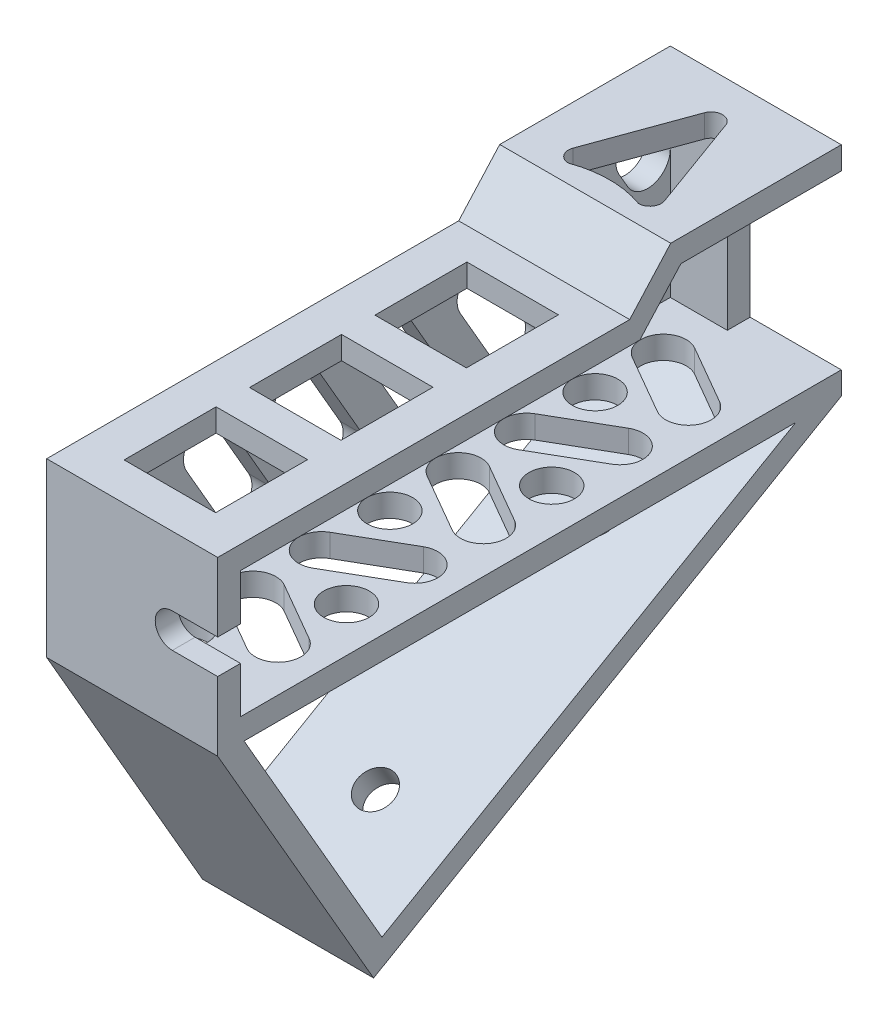
from build123d import *

# Parameters (mm, degrees)
EXTRUDE_1_DEPTH     = 15
EXTRUDE_2_DEPTH     = 2
CUT_EXTRUDE_1_REACH = 61.227
EXTRUDE_3_DEPTH     = 15
CUT_EXTRUDE_2_REACH = 64.285
SKETCH_4_W          = 8
SKETCH_4_H          = 15.1
CUT_EXTRUDE_3_REACH = 50.798
SKETCH_5_R          = 1.6
CUT_EXTRUDE_5_REACH = 42.44
CUT_EXTRUDE_6_REACH = 54.949
SKETCH_7_W          = 8.022612094
SKETCH_7_H          = 8.068386681
CUT_EXTRUDE_7_REACH = 42.408
SKETCH_8_R          = 2


with BuildPart() as part:
    # 草图1 → 凸台-拉伸1 (new body)
    with BuildSketch(Plane(origin=(0, 0, 0), x_dir=(0, 0, -1), z_dir=(1, 0, 0))):
        Polygon((27.35, 17.05), (12.38700707, 17.05), (8.78700707, 13.05), (-27.35, 13.05), (-27.35, -2.05), (27.35, -2.05), align=None)
        Polygon((9.67773188, 11.05), (13.27773188, 15.05), (25.35, 15.05), (25.35, -0.05), (-25.35, -0.05), (-25.35, 11.05), align=None, mode=Mode.SUBTRACT)
    extrude(amount=EXTRUDE_1_DEPTH)

    # 草图1<3> → 凸台-拉伸2 (add)
    with BuildSketch(Plane(origin=(0, 0, 0), x_dir=(0, 0, -1), z_dir=(1, 0, 0))):
        Polygon((25.35, 15.05), (13.27773188, 15.05), (9.67773188, 11.05), (-25.35, 11.05), (-25.35, -0.05), (25.35, -0.05), align=None)
    extrude(amount=EXTRUDE_2_DEPTH)

    # 草图2 → 切除-拉伸1 (cut, up to next)
    with BuildSketch(Plane.XY.offset(27.35), mode=Mode.PRIVATE) as cut_extrude_1_sk1:
        with BuildLine():
            Line((15, 7), (11.02, 7))
            ThreePointArc((11.02, 7), (9.52, 5.5), (11.02, 4))
            Line((11.02, 4), (15, 4))
            Line((15, 4), (15, 7))
        make_face()
    cut_extrude_1_tool1 = extrude(cut_extrude_1_sk1.sketch, amount=-CUT_EXTRUDE_1_REACH, mode=Mode.PRIVATE) & part.part
    add(cut_extrude_1_tool1.solids().sort_by_distance((12.410086, 5.5, 27.35))[0], mode=Mode.SUBTRACT)

    # 草图3 → 凸台-拉伸3 (add)
    with BuildSketch(Plane(origin=(0, 0, 0), x_dir=(0, 0, -1), z_dir=(1, 0, 0))):
        Polygon((-13.675, -25.735794794), (27.35, -2.05), (23.35, -2.05), (-12.942949192, -23.003743986), (-25.040598923, -2.05), (-27.35, -2.05), align=None)
    extrude(amount=EXTRUDE_3_DEPTH)

    # 草图4 → 切除-拉伸2 (cut, up to next)
    with BuildSketch(Plane(origin=(0, 0, -27.35), x_dir=(-1, 0, 0), z_dir=(0, 0, -1)), mode=Mode.PRIVATE) as cut_extrude_2_sk1:
        with Locations((-11, 7.5)):
            Rectangle(SKETCH_4_W, SKETCH_4_H)
    cut_extrude_2_tool1 = extrude(cut_extrude_2_sk1.sketch, amount=-CUT_EXTRUDE_2_REACH, mode=Mode.PRIVATE) & part.part
    add(cut_extrude_2_tool1.solids().sort_by_distance((11, 7.5, -27.35))[0], mode=Mode.SUBTRACT)

    # 草图5 → 切除-拉伸3 (cut, up to next)
    with BuildSketch(Plane(origin=(0, -13.380397397, -7.725176039), x_dir=(1, 0, 0), z_dir=(0, -0.8660254037844414, -0.49999999999999517)), mode=Mode.PRIVATE) as cut_extrude_3_sk1:
        with Locations((7.5, 14.710794794)):
            Circle(SKETCH_5_R)
    cut_extrude_3_tool1 = extrude(cut_extrude_3_sk1.sketch, amount=-CUT_EXTRUDE_3_REACH, mode=Mode.PRIVATE) & part.part
    # 草图5 → 切除-拉伸3 (cut, up to next)
    with BuildSketch(Plane(origin=(0, -13.380397397, -7.725176039), x_dir=(1, 0, 0), z_dir=(0, -0.8660254037844414, -0.49999999999999517)), mode=Mode.PRIVATE) as cut_extrude_3_sk2:
        with Locations((7.5, -7.660794794)):
            Circle(SKETCH_5_R)
    cut_extrude_3_tool2 = extrude(cut_extrude_3_sk2.sketch, amount=-CUT_EXTRUDE_3_REACH, mode=Mode.PRIVATE) & part.part
    add(cut_extrude_3_tool1.solids().sort_by_distance((7.5, -20.735795, 5.014746))[0], mode=Mode.SUBTRACT)
    add(cut_extrude_3_tool2.solids().sort_by_distance((7.5, -9.55, -14.359619))[0], mode=Mode.SUBTRACT)

    # 草图6 → 切除-拉伸5 (cut, up to next)
    with BuildSketch(Plane(origin=(0, 0, 0), x_dir=(0, 0, -1), z_dir=(1, 0, 0)), mode=Mode.PRIVATE) as cut_extrude_5_sk1:
        with BuildLine():
            Line((-17.617949192, 3.035898385), (-21.617949192, 9.964101615))
            ThreePointArc((-21.617949192, 9.964101615), (-24.35, 10.696152423), (-25.082050808, 7.964101615))
            Line((-25.082050808, 7.964101615), (-21.082050808, 1.035898385))
            ThreePointArc((-21.082050808, 1.035898385), (-18.35, 0.303847577), (-17.617949192, 3.035898385))
        make_face()
    cut_extrude_5_tool1 = extrude(cut_extrude_5_sk1.sketch, amount=CUT_EXTRUDE_5_REACH, mode=Mode.PRIVATE) & part.part
    # 草图6 → 切除-拉伸5 (cut, up to next)
    with BuildSketch(Plane(origin=(0, 0, 0), x_dir=(0, 0, -1), z_dir=(1, 0, 0)), mode=Mode.PRIVATE) as cut_extrude_5_sk2:
        with BuildLine():
            Line((-9.617949192, 3.035898385), (-13.617949192, 9.964101615))
            ThreePointArc((-13.617949192, 9.964101615), (-16.35, 10.696152423), (-17.082050808, 7.964101615))
            Line((-17.082050808, 7.964101615), (-13.082050808, 1.035898385))
            ThreePointArc((-13.082050808, 1.035898385), (-10.35, 0.303847577), (-9.617949192, 3.035898385))
        make_face()
    cut_extrude_5_tool2 = extrude(cut_extrude_5_sk2.sketch, amount=CUT_EXTRUDE_5_REACH, mode=Mode.PRIVATE) & part.part
    # 草图6 → 切除-拉伸5 (cut, up to next)
    with BuildSketch(Plane(origin=(0, 0, 0), x_dir=(0, 0, -1), z_dir=(1, 0, 0)), mode=Mode.PRIVATE) as cut_extrude_5_sk3:
        with BuildLine():
            Line((-1.617949192, 3.035898385), (-5.617949192, 9.964101615))
            ThreePointArc((-5.617949192, 9.964101615), (-8.35, 10.696152423), (-9.082050808, 7.964101615))
            Line((-9.082050808, 7.964101615), (-5.082050808, 1.035898385))
            ThreePointArc((-5.082050808, 1.035898385), (-2.35, 0.303847577), (-1.617949192, 3.035898385))
        make_face()
    cut_extrude_5_tool3 = extrude(cut_extrude_5_sk3.sketch, amount=CUT_EXTRUDE_5_REACH, mode=Mode.PRIVATE) & part.part
    # 草图6 → 切除-拉伸5 (cut, up to next)
    with BuildSketch(Plane(origin=(0, 0, 0), x_dir=(0, 0, -1), z_dir=(1, 0, 0)), mode=Mode.PRIVATE) as cut_extrude_5_sk4:
        with BuildLine():
            Line((6.382050808, 3.035898385), (2.382050808, 9.964101615))
            ThreePointArc((2.382050808, 9.964101615), (-0.35, 10.696152423), (-1.082050808, 7.964101615))
            Line((-1.082050808, 7.964101615), (2.917949192, 1.035898385))
            ThreePointArc((2.917949192, 1.035898385), (5.65, 0.303847577), (6.382050808, 3.035898385))
        make_face()
    cut_extrude_5_tool4 = extrude(cut_extrude_5_sk4.sketch, amount=CUT_EXTRUDE_5_REACH, mode=Mode.PRIVATE) & part.part
    # 草图6 → 切除-拉伸5 (cut, up to next)
    with BuildSketch(Plane(origin=(0, 0, 0), x_dir=(0, 0, -1), z_dir=(1, 0, 0)), mode=Mode.PRIVATE) as cut_extrude_5_sk5:
        with BuildLine():
            Line((14.382050808, 3.035898385), (10.382050808, 9.964101615))
            ThreePointArc((10.382050808, 9.964101615), (7.65, 10.696152423), (6.917949192, 7.964101615))
            Line((6.917949192, 7.964101615), (10.917949192, 1.035898385))
            ThreePointArc((10.917949192, 1.035898385), (13.65, 0.303847577), (14.382050808, 3.035898385))
        make_face()
    cut_extrude_5_tool5 = extrude(cut_extrude_5_sk5.sketch, amount=CUT_EXTRUDE_5_REACH, mode=Mode.PRIVATE) & part.part
    # 草图6 → 切除-拉伸5 (cut, up to next)
    with BuildSketch(Plane(origin=(0, 0, 0), x_dir=(0, 0, -1), z_dir=(1, 0, 0)), mode=Mode.PRIVATE) as cut_extrude_5_sk6:
        with BuildLine():
            Line((22.382050808, 3.035898385), (16.31173141, 13.55))
            ThreePointArc((16.31173141, 13.55), (13.579680602, 14.282050808), (12.847629795, 11.55))
            Line((12.847629795, 11.55), (18.917949192, 1.035898385))
            ThreePointArc((18.917949192, 1.035898385), (21.65, 0.303847577), (22.382050808, 3.035898385))
        make_face()
    cut_extrude_5_tool6 = extrude(cut_extrude_5_sk6.sketch, amount=CUT_EXTRUDE_5_REACH, mode=Mode.PRIVATE) & part.part
    # 草图6 → 切除-拉伸5 (cut, up to next)
    with BuildSketch(Plane(origin=(0, 0, 0), x_dir=(0, 0, -1), z_dir=(1, 0, 0)), mode=Mode.PRIVATE) as cut_extrude_5_sk7:
        with BuildLine():
            Line((25.082050808, 12.215767665), (24.31173141, 13.55))
            ThreePointArc((24.31173141, 13.55), (21.579680602, 14.282050808), (20.847629795, 11.55))
            Line((20.847629795, 11.55), (21.617949192, 10.215767665))
            ThreePointArc((21.617949192, 10.215767665), (24.35, 9.483716857), (25.082050808, 12.215767665))
        make_face()
    cut_extrude_5_tool7 = extrude(cut_extrude_5_sk7.sketch, amount=CUT_EXTRUDE_5_REACH, mode=Mode.PRIVATE) & part.part
    add(cut_extrude_5_tool1.solids().sort_by_distance((0, 5.5, 21.35))[0], mode=Mode.SUBTRACT)
    add(cut_extrude_5_tool2.solids().sort_by_distance((0, 5.5, 13.35))[0], mode=Mode.SUBTRACT)
    add(cut_extrude_5_tool3.solids().sort_by_distance((0, 5.5, 5.35))[0], mode=Mode.SUBTRACT)
    add(cut_extrude_5_tool4.solids().sort_by_distance((0, 5.5, -2.65))[0], mode=Mode.SUBTRACT)
    add(cut_extrude_5_tool5.solids().sort_by_distance((0, 5.5, -10.65))[0], mode=Mode.SUBTRACT)
    add(cut_extrude_5_tool6.solids().sort_by_distance((0, 7.292949, -17.61484))[0], mode=Mode.SUBTRACT)
    add(cut_extrude_5_tool7.solids().sort_by_distance((0, 11.882884, -22.96484))[0], mode=Mode.SUBTRACT)

    # 草图7 → 切除-拉伸6 (cut, up to next)
    with BuildSketch(Plane(origin=(0, 17.05, 0), x_dir=(1, 0, 0), z_dir=(0, 1, 0)), mode=Mode.PRIVATE) as cut_extrude_6_sk1:
        with BuildLine():
            Line((3.488693953, 15.329027214), (6.560307379, 23.768215743))
            ThreePointArc((6.560307379, 23.768215743), (7.5, 24.4261956), (8.439692621, 23.768215743))
            Line((8.439692621, 23.768215743), (11.511306047, 15.329027214))
            ThreePointArc((11.511306047, 15.329027214), (11.39076547, 14.413430634), (10.571613426, 13.98700707))
            ThreePointArc((10.571613426, 13.98700707), (7.5, 14.527385864), (4.428386574, 13.98700707))
            ThreePointArc((4.428386574, 13.98700707), (3.60923453, 14.413430634), (3.488693953, 15.329027214))
        make_face()
    cut_extrude_6_tool1 = extrude(cut_extrude_6_sk1.sketch, amount=-CUT_EXTRUDE_6_REACH, mode=Mode.PRIVATE) & part.part
    # 草图7 → 切除-拉伸6 (cut, up to next)
    with BuildSketch(Plane(origin=(0, 17.05, 0), x_dir=(1, 0, 0), z_dir=(0, 1, 0)), mode=Mode.PRIVATE) as cut_extrude_6_sk2:
        with Locations((7.5, -9.01299293)):
            Rectangle(SKETCH_7_W, SKETCH_7_H)
    cut_extrude_6_tool2 = extrude(cut_extrude_6_sk2.sketch, amount=-CUT_EXTRUDE_6_REACH, mode=Mode.PRIVATE) & part.part
    # 草图7 → 切除-拉伸6 (cut, up to next)
    with BuildSketch(Plane(origin=(0, 17.05, 0), x_dir=(1, 0, 0), z_dir=(0, 1, 0)), mode=Mode.PRIVATE) as cut_extrude_6_sk3:
        with Locations((7.5, 1.987007071)):
            Rectangle(SKETCH_7_W, SKETCH_7_H)
    cut_extrude_6_tool3 = extrude(cut_extrude_6_sk3.sketch, amount=-CUT_EXTRUDE_6_REACH, mode=Mode.PRIVATE) & part.part
    # 草图7 → 切除-拉伸6 (cut, up to next)
    with BuildSketch(Plane(origin=(0, 17.05, 0), x_dir=(1, 0, 0), z_dir=(0, 1, 0)), mode=Mode.PRIVATE) as cut_extrude_6_sk4:
        with Locations((7.5, -20.01299293)):
            Rectangle(SKETCH_7_W, SKETCH_7_H)
    cut_extrude_6_tool4 = extrude(cut_extrude_6_sk4.sketch, amount=-CUT_EXTRUDE_6_REACH, mode=Mode.PRIVATE) & part.part
    add(cut_extrude_6_tool1.solids().sort_by_distance((7.5, 17.05, -18.142881))[0], mode=Mode.SUBTRACT)
    add(cut_extrude_6_tool2.solids().sort_by_distance((7.5, 17.05, 9.012993))[0], mode=Mode.SUBTRACT)
    add(cut_extrude_6_tool3.solids().sort_by_distance((7.5, 17.05, -1.987007))[0], mode=Mode.SUBTRACT)
    add(cut_extrude_6_tool4.solids().sort_by_distance((7.5, 17.05, 20.012993))[0], mode=Mode.SUBTRACT)

    # 草图8 → 切除-拉伸7 (cut, up to next)
    with BuildSketch(Plane(origin=(0, -0.05, 0), x_dir=(1, 0, 0), z_dir=(0, 1, 0)), mode=Mode.PRIVATE) as cut_extrude_7_sk1:
        with Locations((5.901923789, 14.85)):
            Circle(SKETCH_8_R)
    cut_extrude_7_tool1 = extrude(cut_extrude_7_sk1.sketch, amount=-CUT_EXTRUDE_7_REACH, mode=Mode.PRIVATE) & part.part
    # 草图8 → 切除-拉伸7 (cut, up to next)
    with BuildSketch(Plane(origin=(0, -0.05, 0), x_dir=(1, 0, 0), z_dir=(0, 1, 0)), mode=Mode.PRIVATE) as cut_extrude_7_sk2:
        with Locations((11.098076211, 5.85)):
            Circle(SKETCH_8_R)
    cut_extrude_7_tool2 = extrude(cut_extrude_7_sk2.sketch, amount=-CUT_EXTRUDE_7_REACH, mode=Mode.PRIVATE) & part.part
    # 草图8 → 切除-拉伸7 (cut, up to next)
    with BuildSketch(Plane(origin=(0, -0.05, 0), x_dir=(1, 0, 0), z_dir=(0, 1, 0)), mode=Mode.PRIVATE) as cut_extrude_7_sk3:
        with Locations((5.901923789, -3.15)):
            Circle(SKETCH_8_R)
    cut_extrude_7_tool3 = extrude(cut_extrude_7_sk3.sketch, amount=-CUT_EXTRUDE_7_REACH, mode=Mode.PRIVATE) & part.part
    # 草图8 → 切除-拉伸7 (cut, up to next)
    with BuildSketch(Plane(origin=(0, -0.05, 0), x_dir=(1, 0, 0), z_dir=(0, 1, 0)), mode=Mode.PRIVATE) as cut_extrude_7_sk4:
        with Locations((11.098076211, -12.15)):
            Circle(SKETCH_8_R)
    cut_extrude_7_tool4 = extrude(cut_extrude_7_sk4.sketch, amount=-CUT_EXTRUDE_7_REACH, mode=Mode.PRIVATE) & part.part
    # 草图8 → 切除-拉伸7 (cut, up to next)
    with BuildSketch(Plane(origin=(0, -0.05, 0), x_dir=(1, 0, 0), z_dir=(0, 1, 0)), mode=Mode.PRIVATE) as cut_extrude_7_sk5:
        with Locations((5.901923789, -21.15)):
            Circle(SKETCH_8_R)
    cut_extrude_7_tool5 = extrude(cut_extrude_7_sk5.sketch, amount=-CUT_EXTRUDE_7_REACH, mode=Mode.PRIVATE) & part.part
    # 草图8 → 切除-拉伸7 (cut, up to next)
    with BuildSketch(Plane(origin=(0, -0.05, 0), x_dir=(1, 0, 0), z_dir=(0, 1, 0)), mode=Mode.PRIVATE) as cut_extrude_7_sk6:
        with BuildLine():
            Line((6.901923789, 22.582050808), (12.098076211, 19.582050808))
            ThreePointArc((12.098076211, 19.582050808), (12.830127019, 16.85), (10.098076211, 16.117949192))
            Line((10.098076211, 16.117949192), (4.901923789, 19.117949192))
            ThreePointArc((4.901923789, 19.117949192), (4.169872981, 21.85), (6.901923789, 22.582050808))
        make_face()
    cut_extrude_7_tool6 = extrude(cut_extrude_7_sk6.sketch, amount=-CUT_EXTRUDE_7_REACH, mode=Mode.PRIVATE) & part.part
    # 草图8 → 切除-拉伸7 (cut, up to next)
    with BuildSketch(Plane(origin=(0, -0.05, 0), x_dir=(1, 0, 0), z_dir=(0, 1, 0)), mode=Mode.PRIVATE) as cut_extrude_7_sk7:
        with BuildLine():
            Line((4.901923789, 10.582050808), (10.098076211, 13.582050808))
            ThreePointArc((10.098076211, 13.582050808), (12.830127019, 12.85), (12.098076211, 10.117949192))
            Line((12.098076211, 10.117949192), (6.901923789, 7.117949192))
            ThreePointArc((6.901923789, 7.117949192), (4.169872981, 7.85), (4.901923789, 10.582050808))
        make_face()
    cut_extrude_7_tool7 = extrude(cut_extrude_7_sk7.sketch, amount=-CUT_EXTRUDE_7_REACH, mode=Mode.PRIVATE) & part.part
    # 草图8 → 切除-拉伸7 (cut, up to next)
    with BuildSketch(Plane(origin=(0, -0.05, 0), x_dir=(1, 0, 0), z_dir=(0, 1, 0)), mode=Mode.PRIVATE) as cut_extrude_7_sk8:
        with BuildLine():
            Line((6.901923789, 4.582050808), (12.098076211, 1.582050808))
            ThreePointArc((12.098076211, 1.582050808), (12.830127019, -1.15), (10.098076211, -1.882050808))
            Line((10.098076211, -1.882050808), (4.901923789, 1.117949192))
            ThreePointArc((4.901923789, 1.117949192), (4.169872981, 3.85), (6.901923789, 4.582050808))
        make_face()
    cut_extrude_7_tool8 = extrude(cut_extrude_7_sk8.sketch, amount=-CUT_EXTRUDE_7_REACH, mode=Mode.PRIVATE) & part.part
    # 草图8 → 切除-拉伸7 (cut, up to next)
    with BuildSketch(Plane(origin=(0, -0.05, 0), x_dir=(1, 0, 0), z_dir=(0, 1, 0)), mode=Mode.PRIVATE) as cut_extrude_7_sk9:
        with BuildLine():
            Line((4.901923789, -7.417949192), (10.098076211, -4.417949192))
            ThreePointArc((10.098076211, -4.417949192), (12.830127019, -5.15), (12.098076211, -7.882050808))
            Line((12.098076211, -7.882050808), (6.901923789, -10.882050808))
            ThreePointArc((6.901923789, -10.882050808), (4.169872981, -10.15), (4.901923789, -7.417949192))
        make_face()
    cut_extrude_7_tool9 = extrude(cut_extrude_7_sk9.sketch, amount=-CUT_EXTRUDE_7_REACH, mode=Mode.PRIVATE) & part.part
    # 草图8 → 切除-拉伸7 (cut, up to next)
    with BuildSketch(Plane(origin=(0, -0.05, 0), x_dir=(1, 0, 0), z_dir=(0, 1, 0)), mode=Mode.PRIVATE) as cut_extrude_7_sk10:
        with BuildLine():
            Line((6.901923789, -13.417949192), (12.098076211, -16.417949192))
            ThreePointArc((12.098076211, -16.417949192), (12.830127019, -19.15), (10.098076211, -19.882050808))
            Line((10.098076211, -19.882050808), (4.901923789, -16.882050808))
            ThreePointArc((4.901923789, -16.882050808), (4.169872981, -14.15), (6.901923789, -13.417949192))
        make_face()
    cut_extrude_7_tool10 = extrude(cut_extrude_7_sk10.sketch, amount=-CUT_EXTRUDE_7_REACH, mode=Mode.PRIVATE) & part.part
    add(cut_extrude_7_tool1.solids().sort_by_distance((5.901924, -0.05, -14.85))[0], mode=Mode.SUBTRACT)
    add(cut_extrude_7_tool2.solids().sort_by_distance((11.098076, -0.05, -5.85))[0], mode=Mode.SUBTRACT)
    add(cut_extrude_7_tool3.solids().sort_by_distance((5.901924, -0.05, 3.15))[0], mode=Mode.SUBTRACT)
    add(cut_extrude_7_tool4.solids().sort_by_distance((11.098076, -0.05, 12.15))[0], mode=Mode.SUBTRACT)
    add(cut_extrude_7_tool5.solids().sort_by_distance((5.901924, -0.05, 21.15))[0], mode=Mode.SUBTRACT)
    add(cut_extrude_7_tool6.solids().sort_by_distance((8.5, -0.05, -19.35))[0], mode=Mode.SUBTRACT)
    add(cut_extrude_7_tool7.solids().sort_by_distance((8.5, -0.05, -10.35))[0], mode=Mode.SUBTRACT)
    add(cut_extrude_7_tool8.solids().sort_by_distance((8.5, -0.05, -1.35))[0], mode=Mode.SUBTRACT)
    add(cut_extrude_7_tool9.solids().sort_by_distance((8.5, -0.05, 7.65))[0], mode=Mode.SUBTRACT)
    add(cut_extrude_7_tool10.solids().sort_by_distance((8.5, -0.05, 16.65))[0], mode=Mode.SUBTRACT)


solid = part.part
